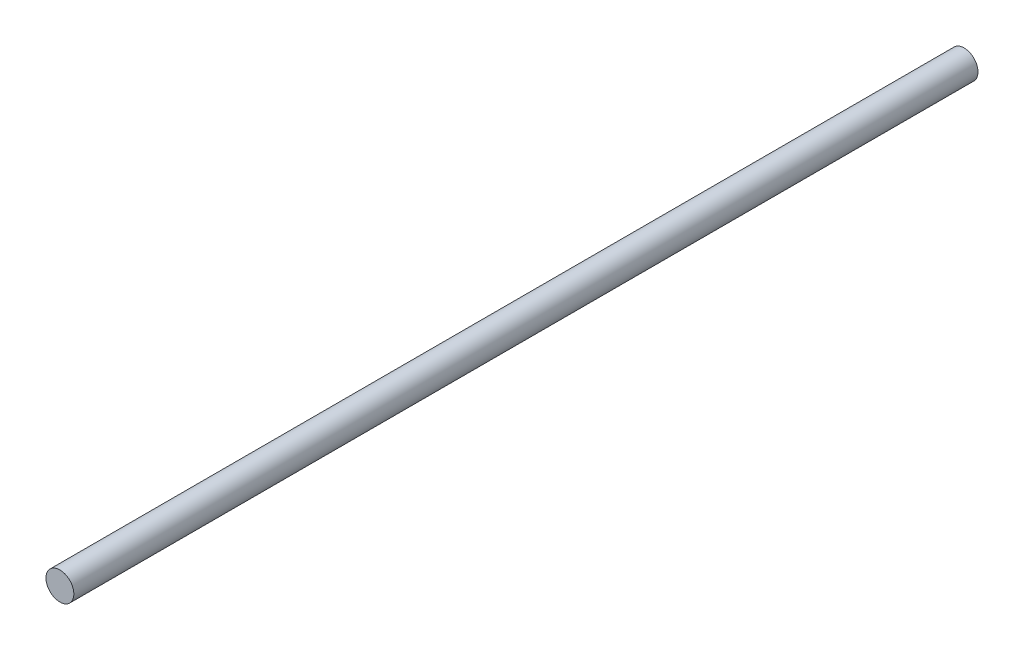
from build123d import *

# Parameters (mm, degrees)
ESBO_O1_R                = 3
RESSALTO_EXTRUS_O1_DEPTH = 194.8


with BuildPart() as part:
    # Esboço1 → Ressalto-extrusão1 (new body)
    with BuildSketch(Plane.XY):
        Circle(ESBO_O1_R)
    extrude(amount=RESSALTO_EXTRUS_O1_DEPTH)


solid = part.part
